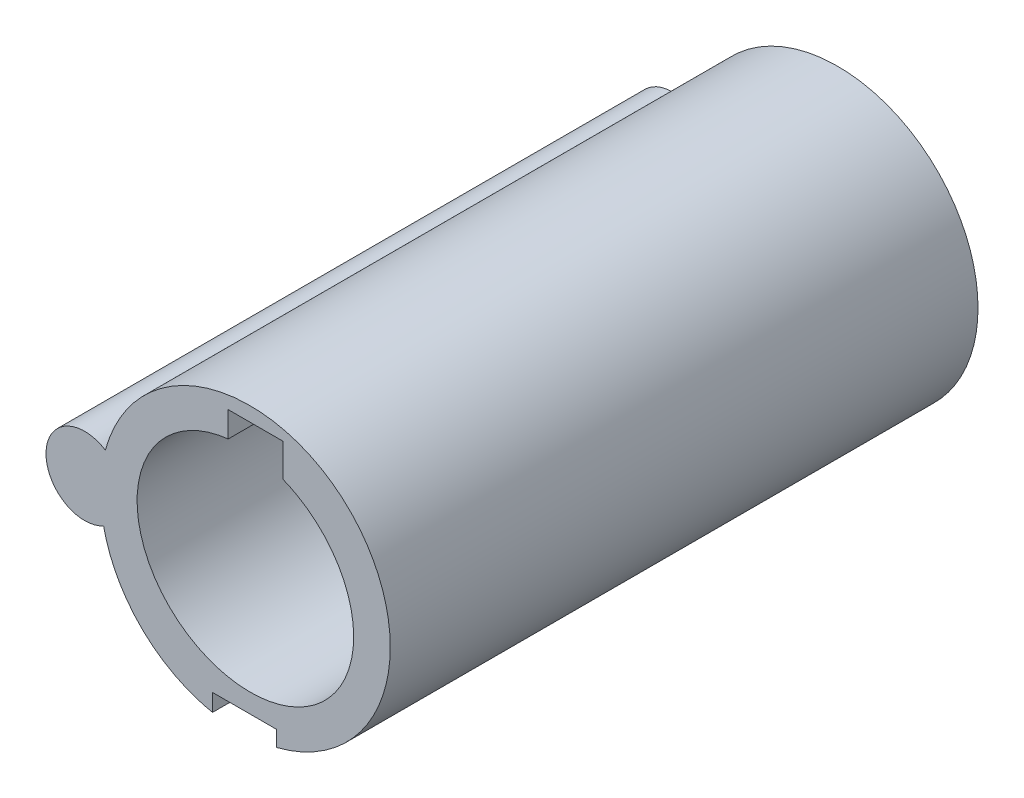
from build123d import *

# Parameters (mm, degrees)
ESQUISSE1_RX            = 42.396864719
ESQUISSE1_RY            = 41.029112223
ESQUISSE1_RX_2          = 31.648634461
ESQUISSE1_RY_2          = 29.877092437
BOSS_EXTRU_1_DEPTH      = 170
ESQUISSE2_W             = 15.792738377
ESQUISSE2_H             = 16.344932025
ESQUISSE2_W_2           = 18.553706624
ESQUISSE2_H_2           = 11.816944099
ENL_V_MAT_EXTRU_1_DEPTH = 170
ESQUISSE3_R             = 11.193216681
BOSS_EXTRU_2_DEPTH      = 170


with BuildPart() as part:
    # Esquisse1 → Boss.-Extru.1 (new body)
    with BuildSketch(Plane.XY):
        with Locations(Location((0, 0), (0, 0, 37.303948278))):
            Ellipse(ESQUISSE1_RX, ESQUISSE1_RY)
        with Locations(Location((0, 0), (0, 0, -25.781336929))):
            Ellipse(ESQUISSE1_RX_2, ESQUISSE1_RY_2, mode=Mode.SUBTRACT)
    extrude(amount=BOSS_EXTRU_1_DEPTH)

    # Esquisse2 → Enlèv. mat.-Extru.1 (cut)
    with BuildSketch(Plane.XY.offset(170)):
        with Locations((2.926626343, 29.21104406)):
            Rectangle(ESQUISSE2_W, ESQUISSE2_H)
        with Locations((-0.22087746, -41.635401174)):
            Rectangle(ESQUISSE2_W_2, ESQUISSE2_H_2)
    extrude(amount=-ENL_V_MAT_EXTRU_1_DEPTH, mode=Mode.SUBTRACT)

    # Esquisse3 → Boss.-Extru.2 (add)
    with BuildSketch(Plane.XY.offset(170)):
        with Locations((-46.482294325, 0)):
            Circle(ESQUISSE3_R)
    extrude(amount=-BOSS_EXTRU_2_DEPTH)


solid = part.part
